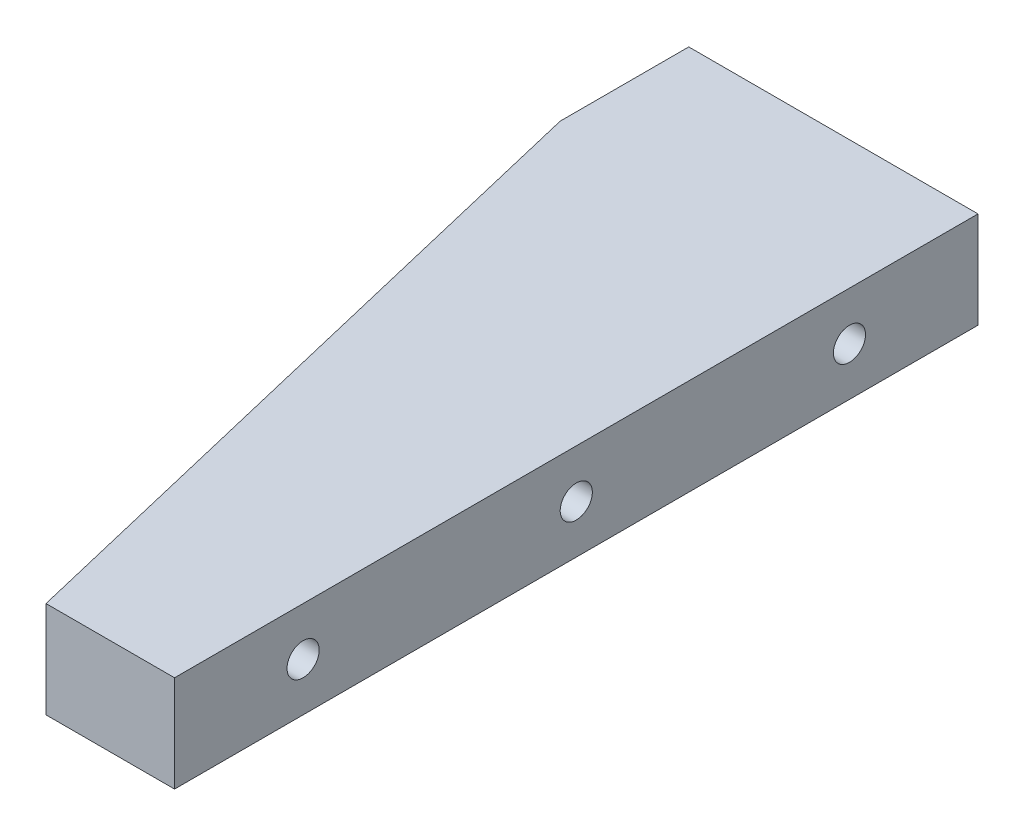
from build123d import *

# Parameters (mm, degrees)
BOSS_EXTRUDE1_DEPTH   = 15
M6_TAPPED_HOLE1_D     = 5
M6_TAPPED_HOLE1_DEPTH = 10
M6_TAPPED_HOLE1_TIP   = 1.502151548
M6_TAPPED_HOLE2_D     = 5
M6_TAPPED_HOLE2_DEPTH = 10
M6_TAPPED_HOLE2_TIP   = 1.502151548


with BuildPart() as part:
    # Sketch1 → Boss-Extrude1 (new body)
    with BuildSketch(Plane(origin=(0, 0, 0), x_dir=(1, 0, 0), z_dir=(0, 1, 0))):
        Polygon((0, 0), (0, -125), (-20, -125), (-45, -20), (-45, 0), align=None)
    extrude(amount=BOSS_EXTRUDE1_DEPTH)

    # M6 Tapped Hole1
    with Locations(Plane(origin=(0, 0, 0), x_dir=(-1, 0, 0), z_dir=(0, 0, -1))):
        with Locations((35, 7.5)):
            Hole(M6_TAPPED_HOLE1_D / 2, depth=M6_TAPPED_HOLE1_DEPTH)
            with Locations((0, 0, -(M6_TAPPED_HOLE1_DEPTH + M6_TAPPED_HOLE1_TIP / 2))):  # 118° drill point
                Cone(0, M6_TAPPED_HOLE1_D / 2, M6_TAPPED_HOLE1_TIP, mode=Mode.SUBTRACT)

    # M6 Tapped Hole2
    with Locations(Plane(origin=(0, 0, 0), x_dir=(0, 0, -1), z_dir=(1, 0, 0))):
        with Locations((-105, 7.5), (-62.5, 7.5), (-20, 7.5)):
            Hole(M6_TAPPED_HOLE2_D / 2, depth=M6_TAPPED_HOLE2_DEPTH)
            with Locations((0, 0, -(M6_TAPPED_HOLE2_DEPTH + M6_TAPPED_HOLE2_TIP / 2))):  # 118° drill point
                Cone(0, M6_TAPPED_HOLE2_D / 2, M6_TAPPED_HOLE2_TIP, mode=Mode.SUBTRACT)


solid = part.part
